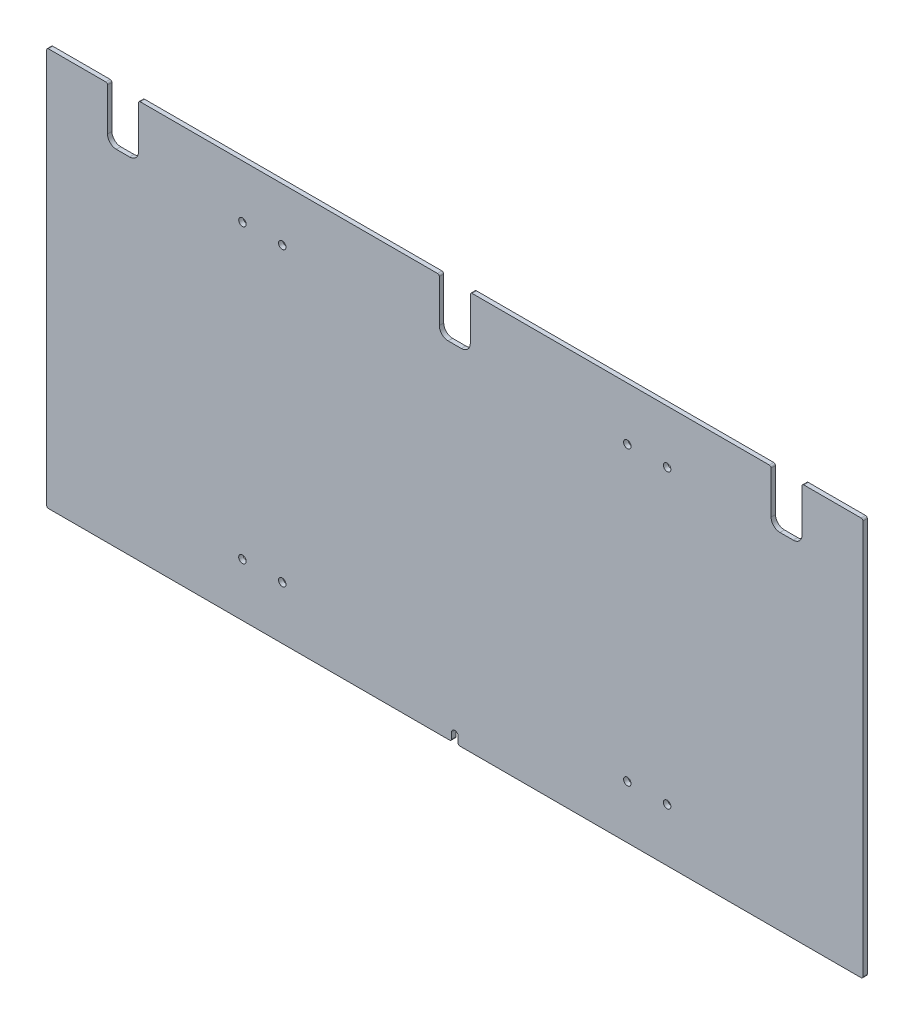
from build123d import *

# Parameters (mm, degrees)
SKETCH1_W                        = 1171.575
SKETCH1_H                        = 571.5
BOSS_EXTRUDE1_DEPTH              = 6.35
F_27_64_0_42188_DIAMETER_HOLE1_D = 10.715752
SKETCH5_W                        = 44.45
SKETCH5_H                        = 76.2
CUT_EXTRUDE1_DEPTH               = 819.412834489
CUT_EXTRUDE2_DEPTH               = 819.412834489
FILLET1_R                        = 12.7
FILLET2_R                        = 2.54


with BuildPart() as part:
    # Sketch1 → Boss-Extrude1 (new body)
    with BuildSketch(Plane.XY):
        with Locations((0, 285.75)):
            Rectangle(SKETCH1_W, SKETCH1_H)
    extrude(amount=BOSS_EXTRUDE1_DEPTH)

    # 27/64 (0.42188) Diameter Hole1 (through all)
    with Locations(Plane.XY.offset(6.35)):
        with Locations((304.8, 495.3), (-247.65, 495.3), (-304.8, 495.3), (-247.65, 76.2), (-304.8, 76.2), (247.65, 76.2), (304.8, 76.2), (247.65, 495.3)):
            Hole(F_27_64_0_42188_DIAMETER_HOLE1_D / 2)

    # Sketch5 → Cut-Extrude1 (cut, through all)
    with BuildSketch(Plane.XY.offset(6.35)):
        with Locations((-476.25, 533.4)):
            Rectangle(SKETCH5_W, SKETCH5_H)
        with Locations((0, 533.4)):
            Rectangle(SKETCH5_W, SKETCH5_H)
        with Locations((476.25, 533.4)):
            Rectangle(SKETCH5_W, SKETCH5_H)
    extrude(amount=-CUT_EXTRUDE1_DEPTH, mode=Mode.SUBTRACT)

    # Sketch6 → Cut-Extrude2 (cut, through all)
    with BuildSketch(Plane.XY.offset(6.35)):
        with BuildLine():
            Line((4.7625, 0), (-4.7625, 0))
            Line((-4.7625, 0), (-4.7625, 11.1125))
            ThreePointArc((-4.7625, 11.1125), (0, 15.875), (4.7625, 11.1125))
            Line((4.7625, 11.1125), (4.7625, 0))
        make_face()
    extrude(amount=-CUT_EXTRUDE2_DEPTH, mode=Mode.SUBTRACT)

    # Fillet1
    fillet1_edges = [part.edges().sort_by_distance(p)[0] for p in [
        (-454.025, 495.3, 3.175),
        (-498.475, 495.3, 3.175),
        (-22.225, 495.3, 3.175),
        (22.225, 495.3, 3.175),
        (454.025, 495.3, 3.175),
        (498.475, 495.3, 3.175),
    ]]
    fillet(fillet1_edges, radius=FILLET1_R)

    # Fillet2
    fillet2_edges = [part.edges().sort_by_distance(p)[0] for p in [
        (4.7625, 0, 3.175),
        (-4.7625, 0, 3.175),
        (-498.475, 571.5, 3.175),
        (-454.025, 571.5, 3.175),
        (-585.7875, 571.5, 3.175),
        (585.7875, 571.5, 3.175),
        (585.7875, 0, 3.175),
        (-22.225, 571.5, 3.175),
        (-585.7875, 0, 3.175),
        (22.225, 571.5, 3.175),
        (454.025, 571.5, 3.175),
        (498.475, 571.5, 3.175),
    ]]
    fillet(fillet2_edges, radius=FILLET2_R)


solid = part.part
